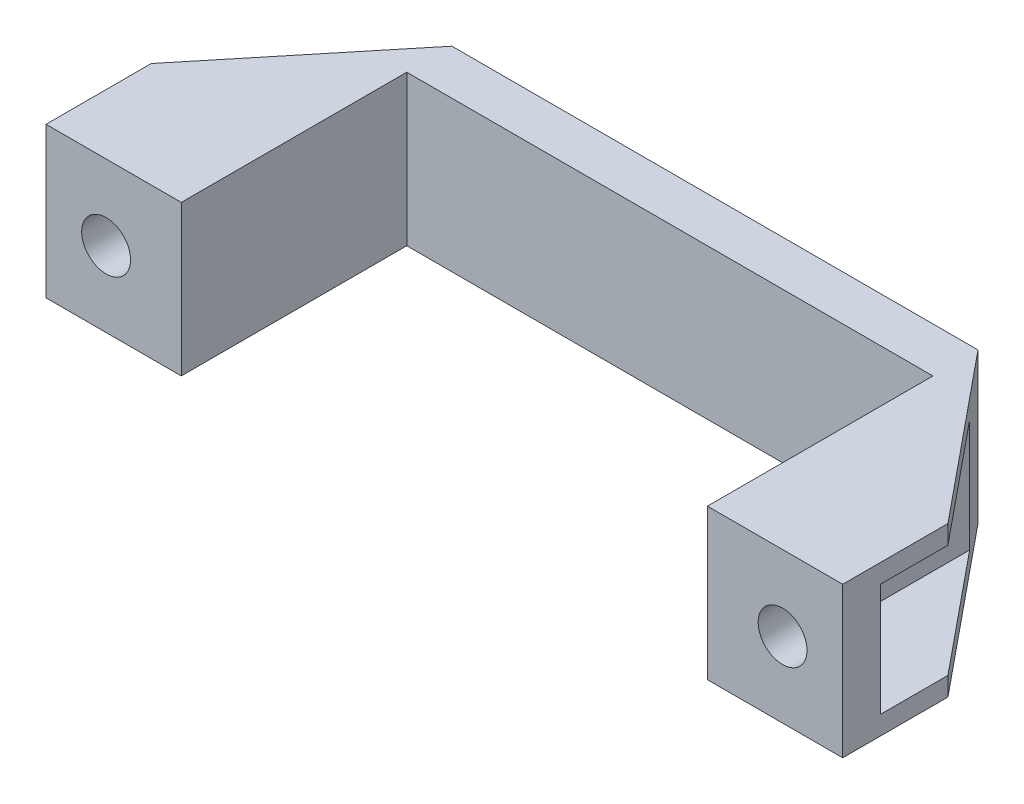
from build123d import *

# Parameters (mm, degrees)
EXTRUDE_1_DEPTH     = 10
SKETCH_2_R          = 3.25
CUT_EXTRUDE_1_DEPTH = 65.845971347
SKETCH_4_W          = 13
SKETCH_4_H          = 24.888888889
CUT_EXTRUDE_2_DEPTH = 7.5


with BuildPart() as part:
    # 草图1 → 凸台-拉伸1 (new, symmetric)
    with BuildSketch(Plane(origin=(0, 0, 0), x_dir=(1, 0, 0), z_dir=(0, 1, 0))):
        Polygon((-53, -18), (-35, -18), (-35, 12), (35, 12), (35, -18), (53, -18), (53, -4), (35, 18), (-35, 18), (-53, -4), align=None)
    extrude(amount=EXTRUDE_1_DEPTH, both=True)

    # 草图2 → 切除-拉伸1 (cut, through all)
    with BuildSketch(Plane.XY.offset(18)):
        with Locations((-45, 0)):
            Circle(SKETCH_2_R)
        with Locations((45, 0)):
            Circle(SKETCH_2_R)
    extrude(amount=-CUT_EXTRUDE_1_DEPTH, mode=Mode.SUBTRACT)

    # 草图4 → 切除-拉伸2 (cut, symmetric)
    with BuildSketch(Plane(origin=(0, 0, 0), x_dir=(1, 0, 0), z_dir=(0, 1, 0))):
        with Locations((46.5, -0.555555555)):
            Rectangle(SKETCH_4_W, SKETCH_4_H)
        with Locations((-46.5, -0.555555555)):
            Rectangle(SKETCH_4_W, SKETCH_4_H)
    extrude(amount=CUT_EXTRUDE_2_DEPTH, both=True, mode=Mode.SUBTRACT)


solid = part.part
